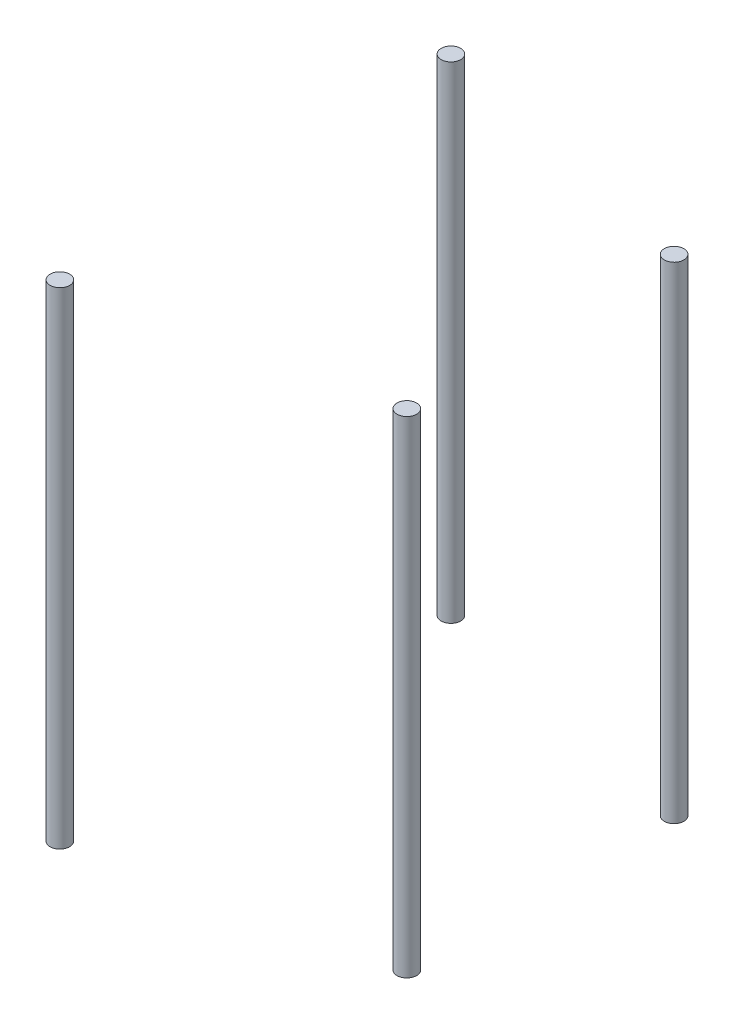
from build123d import *

# Parameters (mm, degrees)
SKETCH2_R             = 6
BOSS_EXTRUDE2_DEPTH   = 298.511867092
BOSS_EXTRUDE2_2_DEPTH = 298.511867092
BOSS_EXTRUDE2_3_DEPTH = 298.511867092
BOSS_EXTRUDE2_4_DEPTH = 298.511867092


with BuildPart() as part:
    # Sketch2 → Boss-Extrude2 (new body)
    with BuildSketch(Plane(origin=(0.000194926, 96.488005517, 0), x_dir=(0.9999999999979595, -2.0202115698660515e-06, 0), z_dir=(2.0202115698660515e-06, 0.9999999999979595, 0))):
        with Locations(Location((-57.058628867, -120.034242926, 0), (0, 0, 180.000000006))):
            Circle(SKETCH2_R)
    extrude(amount=BOSS_EXTRUDE2_DEPTH)


with BuildPart() as body_2:
    # Sketch2 → Boss-Extrude2 2 (new body)
    with BuildSketch(Plane(origin=(0.000194926, 96.488005517, 0), x_dir=(0.9999999999979595, -2.0202115698660515e-06, 0), z_dir=(2.0202115698660515e-06, 0.9999999999979595, 0))):
        with Locations(Location((117.964276061, -82.044262058, 0), (0, 0, 180.000000006))):
            Circle(SKETCH2_R)
    extrude(amount=BOSS_EXTRUDE2_2_DEPTH)


with BuildPart() as body_3:
    # Sketch2 → Boss-Extrude2 3 (new body)
    with BuildSketch(Plane(origin=(0.000194926, 96.488005517, 0), x_dir=(0.9999999999979595, -2.0202115698660515e-06, 0), z_dir=(2.0202115698660515e-06, 0.9999999999979595, 0))):
        with Locations((117.964276061, 82.044262058)):
            Circle(SKETCH2_R)
    extrude(amount=BOSS_EXTRUDE2_3_DEPTH)


with BuildPart() as body_4:
    # Sketch2 → Boss-Extrude2 4 (new body)
    with BuildSketch(Plane(origin=(0.000194926, 96.488005517, 0), x_dir=(0.9999999999979595, -2.0202115698660515e-06, 0), z_dir=(2.0202115698660515e-06, 0.9999999999979595, 0))):
        with Locations((-57.058628867, 120.034242926)):
            Circle(SKETCH2_R)
    extrude(amount=BOSS_EXTRUDE2_4_DEPTH)


solid = Compound([part.part, body_2.part, body_3.part, body_4.part])
